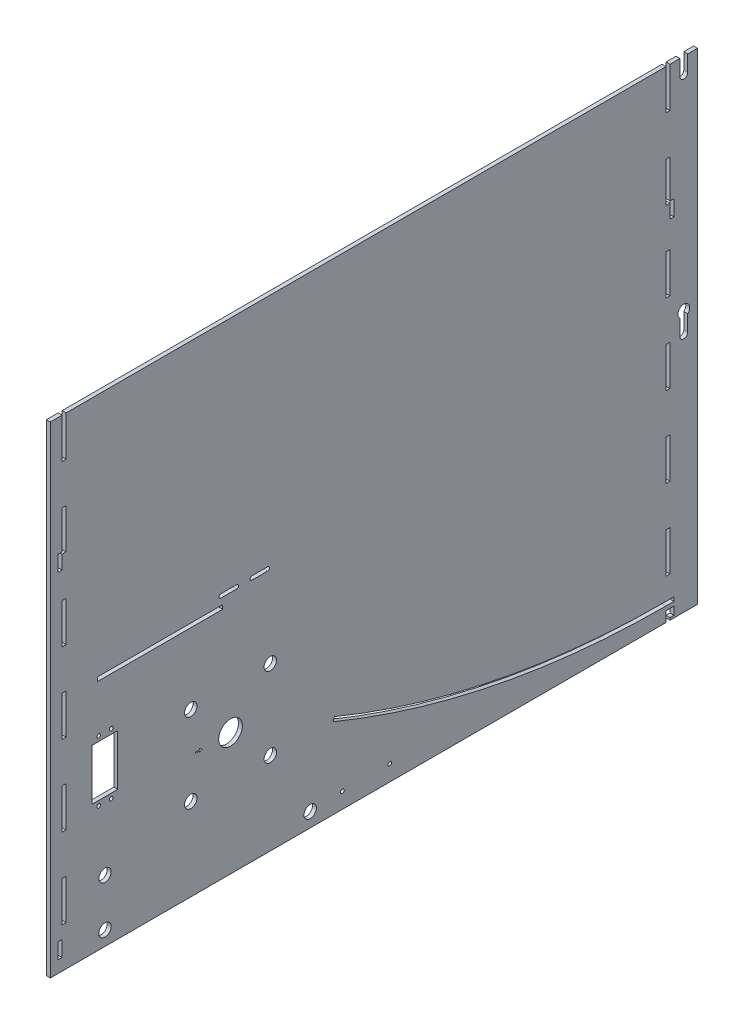
from build123d import *

# Parameters (mm, degrees)
SKETCH1_W           = 488.95
SKETCH1_H           = 387.35
SKETCH1_R           = 5
SKETCH1_R_2         = 1.5
SKETCH1_W_2         = 20.5
SKETCH1_H_2         = 41
SKETCH1_W_3         = 100.522513204
SKETCH1_H_3         = 3.175
SKETCH1_R_3         = 9.525
SKETCH1_W_4         = 9.525
SKETCH1_W_5         = 22.225
BOSS_EXTRUDE1_DEPTH = 3.175
SKETCH2_W           = 3.175
SKETCH2_H           = 32.279166666
SKETCH2_H_2         = 32.279166667
CUT_EXTRUDE1_DEPTH  = 471.296707542
SKETCH3_W           = 6.35
SKETCH3_H           = 3.175
CUT_EXTRUDE2_DEPTH  = 471.296707542
SKETCH4_R           = 5
CUT_EXTRUDE3_DEPTH  = 471.296707542
SKETCH5_R           = 1.5
CUT_EXTRUDE4_DEPTH  = 471.296707542
SKETCH6_W           = 3.175
SKETCH6_H           = 6.35
SKETCH6_H_2         = 12.7
CUT_EXTRUDE5_DEPTH  = 471.296707542
CUT_EXTRUDE6_DEPTH  = 471.296707542


with BuildPart() as part:
    # Sketch1 → Boss-Extrude1 (new body)
    # profile 1 of 3: a face of its own
    with BuildSketch(Plane(origin=(0, 0, 0), x_dir=(0, 0, -1), z_dir=(1, 0, 0))):
        with Locations((0, 193.675)):
            Rectangle(SKETCH1_W, SKETCH1_H)
        with Locations((-141.027486796, 66.552)):
            Circle(SKETCH1_R, mode=Mode.SUBTRACT)
        with Locations((-77.027486796, 66.552)):
            Circle(SKETCH1_R, mode=Mode.SUBTRACT)
        with Locations((-215.115692196, 100.3947974)):
            Circle(SKETCH1_R_2, mode=Mode.SUBTRACT)
        with Locations((-204.955692196, 100.3947974)):
            Circle(SKETCH1_R_2, mode=Mode.SUBTRACT)
        with Locations((-210.035692196, 124.7947974)):
            Rectangle(SKETCH1_W_2, SKETCH1_H_2, mode=Mode.SUBTRACT)
        with Locations((-141.027486796, 130.552)):
            Circle(SKETCH1_R, mode=Mode.SUBTRACT)
        with Locations((-215.115692196, 149.1947974)):
            Circle(SKETCH1_R_2, mode=Mode.SUBTRACT)
        with Locations((-204.955692196, 149.1947974)):
            Circle(SKETCH1_R_2, mode=Mode.SUBTRACT)
        with Locations((-165.638743398, 189.1665)):
            Rectangle(SKETCH1_W_3, SKETCH1_H_3, mode=Mode.SUBTRACT)
        with Locations((-109.027486796, 98.552)):
            Circle(SKETCH1_R_3, mode=Mode.SUBTRACT)
        with Locations((-77.027486796, 130.552)):
            Circle(SKETCH1_R, mode=Mode.SUBTRACT)
        with BuildLine():
            ThreePointArc((241.3, 11.557), (104.709921611, 25.009948505), (-26.631076666, 64.851804754))
            Line((-26.631076666, 64.851804754), (-25.416056769, 67.78512227))
            ThreePointArc((-25.416056769, 67.78512227), (105.329333383, 28.12394177), (241.3, 14.732))
            Line((241.3, 14.732), (241.3, 11.557))
        make_face(mode=Mode.SUBTRACT)
        with BuildLine():
            ThreePointArc((-116.877486796, 196.079), (-118.377486796, 197.579), (-116.877486796, 199.079))
            Line((-116.877486796, 199.079), (-104.177486796, 199.079))
            ThreePointArc((-104.177486796, 199.079), (-102.677486796, 197.579), (-104.177486796, 196.079))
            Line((-104.177486796, 196.079), (-116.877486796, 196.079))
        make_face(mode=Mode.SUBTRACT)
        with BuildLine():
            Line((-79.177486758, 196.079), (-91.877486758, 196.079))
            ThreePointArc((-91.877486758, 196.079), (-93.377486758, 197.579), (-91.877486758, 199.079))
            Line((-91.877486758, 199.079), (-79.177486758, 199.079))
            ThreePointArc((-79.177486758, 199.079), (-77.677486758, 197.579), (-79.177486758, 196.079))
        make_face(mode=Mode.SUBTRACT)
    # profile 2 of 3: a face of its own
    with BuildSketch(Plane(origin=(0, 0, 0), x_dir=(0, 0, -1), z_dir=(1, 0, 0))):
        with Locations((-249.2375, 193.675)):
            Rectangle(SKETCH1_W_4, SKETCH1_H)
    # profile 3 of 3: a face of its own
    with BuildSketch(Plane(origin=(0, 0, 0), x_dir=(0, 0, -1), z_dir=(1, 0, 0))):
        with Locations((255.5875, 193.675)):
            Rectangle(SKETCH1_W_5, SKETCH1_H)
    extrude(amount=BOSS_EXTRUDE1_DEPTH)

    # Sketch2 → Cut-Extrude1 (cut, through all)
    with BuildSketch(Plane.ZY):
        with Locations((-242.8875, 48.41875)):
            Rectangle(SKETCH2_W, SKETCH2_H)
        with Locations((-242.8875, 112.977083334)):
            Rectangle(SKETCH2_W, SKETCH2_H_2)
        with Locations((-242.8875, 177.535416666)):
            Rectangle(SKETCH2_W, SKETCH2_H_2)
        with Locations((-242.8875, 306.652083334)):
            Rectangle(SKETCH2_W, SKETCH2_H_2)
        with Locations((-242.8875, 371.210416667)):
            Rectangle(SKETCH2_W, SKETCH2_H_2)
        with Locations((-242.8875, 242.09375)):
            Rectangle(SKETCH2_W, SKETCH2_H)
        with Locations((242.8875, 371.210416667)):
            Rectangle(SKETCH2_W, SKETCH2_H_2)
        with Locations((242.8875, 306.652083334)):
            Rectangle(SKETCH2_W, SKETCH2_H_2)
        with Locations((242.8875, 242.09375)):
            Rectangle(SKETCH2_W, SKETCH2_H)
        with Locations((242.8875, 177.535416666)):
            Rectangle(SKETCH2_W, SKETCH2_H_2)
        with Locations((242.8875, 112.977083334)):
            Rectangle(SKETCH2_W, SKETCH2_H_2)
        with Locations((242.8875, 48.41875)):
            Rectangle(SKETCH2_W, SKETCH2_H)
    extrude(amount=-CUT_EXTRUDE1_DEPTH, mode=Mode.SUBTRACT)

    # Sketch3 → Cut-Extrude2 (cut, through all)
    with BuildSketch(Plane.ZY):
        with BuildLine():
            Line((-258.7625, 206.375), (-258.7625, 193.675))
            ThreePointArc((-258.7625, 193.675), (-255.5875, 190.5), (-252.4125, 193.675))
            Line((-252.4125, 193.675), (-252.4125, 206.375))
            ThreePointArc((-252.4125, 206.375), (-255.5875, 214.687257914), (-258.7625, 206.375))
        make_face()
        with BuildLine():
            ThreePointArc((-258.7625, 374.65), (-257.83256403, 372.40493597), (-255.5875, 371.475))
            ThreePointArc((-255.5875, 371.475), (-253.34243597, 372.40493597), (-252.4125, 374.65))
            Line((-252.4125, 374.65), (-252.4125, 387.35))
            Line((-252.4125, 387.35), (-258.7625, 387.35))
            Line((-258.7625, 387.35), (-258.7625, 374.65))
        make_face()
        with Locations((-244.475, 13.1445)):
            Rectangle(SKETCH3_W, SKETCH3_H)
    extrude(amount=-CUT_EXTRUDE2_DEPTH, mode=Mode.SUBTRACT)

    # Sketch4 → Cut-Extrude3 (cut, through all)
    with BuildSketch(Plane.ZY):
        with Locations((210.035692196, 49.5947974)):
            Circle(SKETCH4_R)
        with Locations((44.935692196, 11.4947974)):
            Circle(SKETCH4_R)
        with Locations((210.035692196, 11.4947974)):
            Circle(SKETCH4_R)
    extrude(amount=-CUT_EXTRUDE3_DEPTH, mode=Mode.SUBTRACT)

    # Sketch5 → Cut-Extrude4 (cut, through all)
    with BuildSketch(Plane.ZY):
        with Locations((-19.05, 12.7)):
            Circle(SKETCH5_R)
        with Locations((19.05, 12.7)):
            Circle(SKETCH5_R)
    extrude(amount=-CUT_EXTRUDE4_DEPTH, mode=Mode.SUBTRACT)

    # Sketch6 → Cut-Extrude5 (cut, through all)
    with BuildSketch(Plane.ZY):
        Polygon((-244.475, 8.255), (-244.475, 1.905), (-244.475, 0), (-241.3, 0), (-241.3, 8.255), align=None)
        with Locations((-246.0625, 5.08)):
            Rectangle(SKETCH6_W, SKETCH6_H)
        with Locations((-246.0625, 285.75)):
            Rectangle(SKETCH6_W, SKETCH6_H_2)
        with Locations((246.0625, 285.75)):
            Rectangle(SKETCH6_W, SKETCH6_H_2)
        with Locations((246.0625, 15.875)):
            Rectangle(SKETCH6_W, SKETCH6_H_2)
    extrude(amount=-CUT_EXTRUDE5_DEPTH, mode=Mode.SUBTRACT)

    # Sketch7 → Cut-Extrude6 (cut, through all)
    with BuildSketch(Plane.ZY):
        Polygon((137.124709789, 98.948875), (137.124709789, 98.155125), (133.949709789, 98.155125), (133.949709789, 97.361375), (131.887486796, 98.552), (133.949709789, 99.742625), (133.949709789, 98.948875), align=None)
    extrude(amount=-CUT_EXTRUDE6_DEPTH, mode=Mode.SUBTRACT)


solid = part.part
